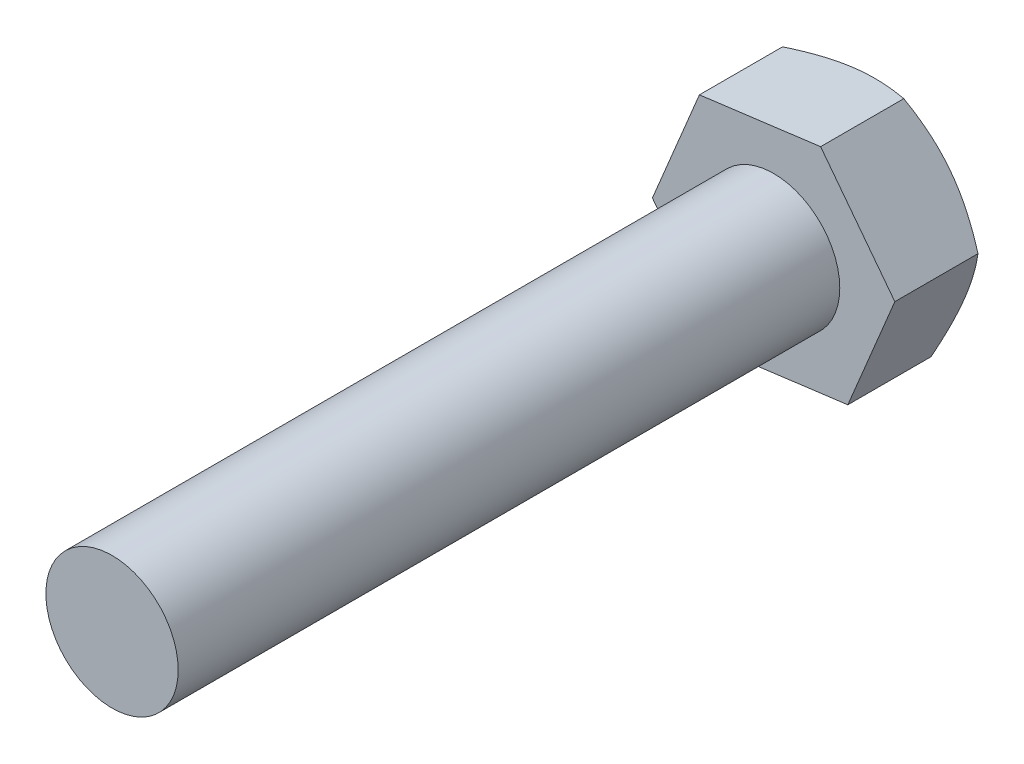
from build123d import *

# Parameters (mm, degrees)
BOSS_EXTRUDE1_DEPTH = 3.5
SKETCH2_OUTSIDE_W   = 31.08
SKETCH2_OUTSIDE_H   = 30.448
SKETCH2_OUTSIDE_R   = 4
CUT_EXTRUDE1_DEPTH  = 5
CUT_EXTRUDE1_DRAFT  = -60
SKETCH3_R           = 2.5
BOSS_EXTRUDE2_DEPTH = 25


with BuildPart() as part:
    # Sketch1 → Boss-Extrude1 (new body)
    with BuildSketch(Plane.XY):
        Polygon((1.77607371, 4.2636716), (-2.804411064, 3.669960751), (-4.580484774, -0.593710848), (-1.77607371, -4.2636716), (2.804411064, -3.669960751), (4.580484774, 0.593710848), align=None)
    extrude(amount=BOSS_EXTRUDE1_DEPTH)


with BuildPart() as cut_extrude1_tool:
    # Sketch2 outside → Cut-Extrude1 (with draft: the straight prism first)
    with BuildSketch(Plane(origin=(0, 0, 0), x_dir=(-1, 0, 0), z_dir=(0, 0, -1))):
        Rectangle(SKETCH2_OUTSIDE_W, SKETCH2_OUTSIDE_H)
        Circle(SKETCH2_OUTSIDE_R, mode=Mode.SUBTRACT)
    extrude(amount=-CUT_EXTRUDE1_DEPTH)
    # Cut-Extrude1: the draft: its side faces are tilted about the plane it starts from
    cut_extrude1_sides = [cut_extrude1_tool.faces().sort_by_distance(p)[0] for p in [
        (0, -15.224, 2.5),
        (-15.54, 0, 2.5),
        (0, 15.224, 2.5),
        (15.54, 0, 2.5),
        (4, 0, 2.5),
    ]]
    draft(cut_extrude1_sides, Plane(origin=(0, 0, 0), x_dir=(-1, 0, 0), z_dir=(0, 0, -1)), CUT_EXTRUDE1_DRAFT)


with BuildPart() as part_1:
    add(part.part)

    # Cut-Extrude1: cut by cut_extrude1_tool
    add(cut_extrude1_tool.part, mode=Mode.SUBTRACT)

    # Sketch3 → Boss-Extrude2 (add)
    with BuildSketch(Plane.XY.offset(3.5)):
        Circle(SKETCH3_R)
    extrude(amount=BOSS_EXTRUDE2_DEPTH)


solid = part_1.part
